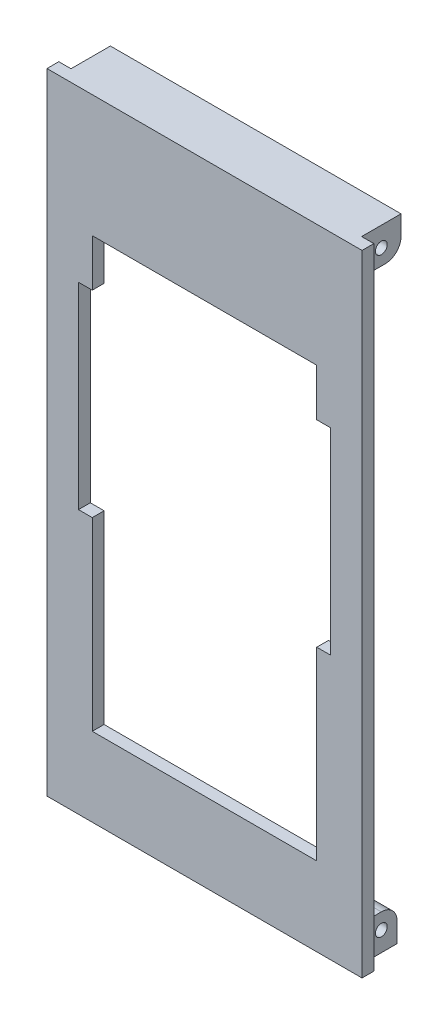
from build123d import *

# Parameters (mm, degrees)
SKETCH3_R           = 1.5
BOSS_EXTRUDE3_DEPTH = 80
CUT_EXTRUDE1_DEPTH  = 180.357185527
SKETCH5_W           = 3.1
SKETCH5_H           = 12
CUT_EXTRUDE2_DEPTH  = 180.357185527
FILLET1_R           = 4


with BuildPart() as part:
    # Sketch3 → Boss-Extrude3 (new body)
    with BuildSketch(Plane(origin=(0, 0, 0), x_dir=(0, 0, -1), z_dir=(1, 0, 0))):
        Polygon((0, 160), (13, 160), (13, 151), (3, 151), (3, 9), (12, 9), (12, 0), (0, 0), align=None)
        with Locations((8, 155)):
            Circle(SKETCH3_R, mode=Mode.SUBTRACT)
        with Locations((8, 5)):
            Circle(SKETCH3_R, mode=Mode.SUBTRACT)
    extrude(amount=BOSS_EXTRUDE3_DEPTH)

    # Sketch4 → Cut-Extrude1 (cut, through all)
    with BuildSketch(Plane.XY):
        Polygon((11.5, 117), (11.5, 129), (68.5, 129), (68.5, 117), (72, 117), (72, 67), (68.5, 67), (68.5, 20), (11.5, 20), (11.5, 67), (8, 67), (8, 117), align=None)
    extrude(amount=-CUT_EXTRUDE1_DEPTH, mode=Mode.SUBTRACT)

    # Sketch5 → Cut-Extrude2 (cut, through all)
    with BuildSketch(Plane(origin=(0, 0, 0), x_dir=(1, 0, 0), z_dir=(0, 1, 0))):
        with Locations((78.45, 9)):
            Rectangle(SKETCH5_W, SKETCH5_H)
        with Locations((1.55, 9)):
            Rectangle(SKETCH5_W, SKETCH5_H)
    extrude(amount=CUT_EXTRUDE2_DEPTH, mode=Mode.SUBTRACT)

    # Fillet1
    fillet1_edges = [part.edges().sort_by_distance(p)[0] for p in [
        (40, 151, -13),
        (40, 9, -12),
    ]]
    fillet(fillet1_edges, radius=FILLET1_R)


solid = part.part
